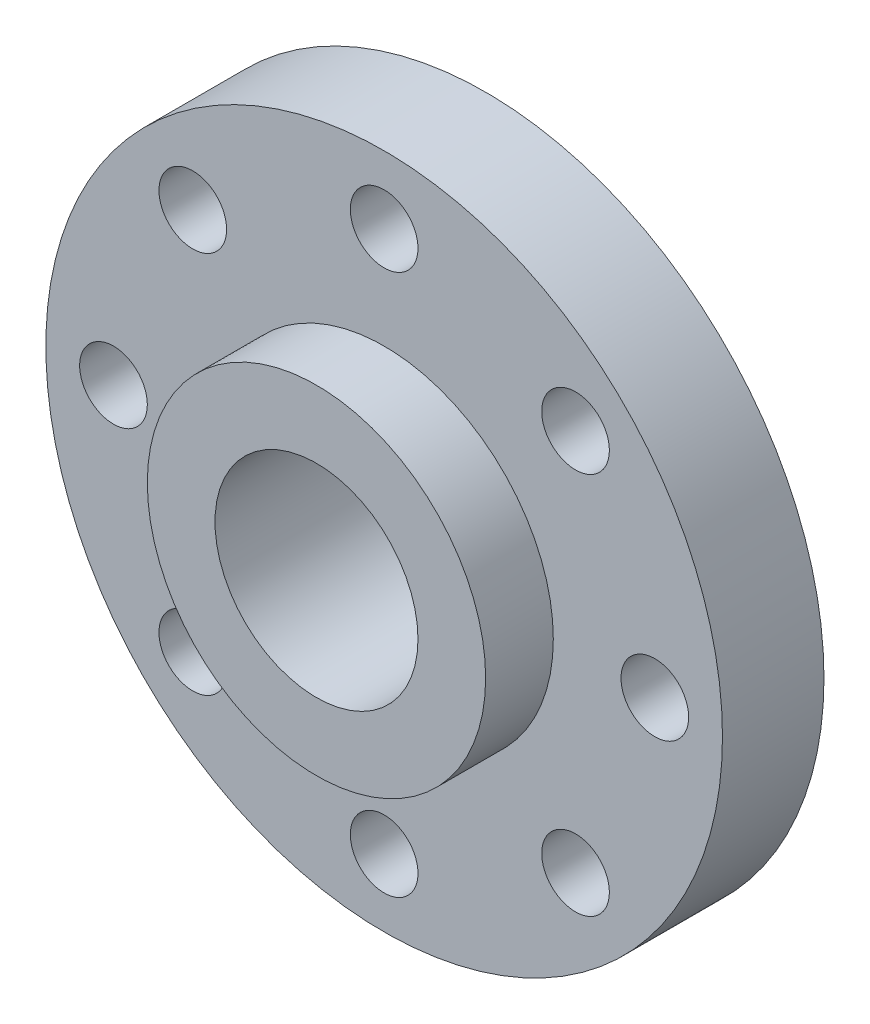
from build123d import *

# Parameters (mm, degrees)
SKETCH_1_R          = 10
EXTRUDE_1_DEPTH     = 3
SKETCH_2_R          = 5
EXTRUDE_2_DEPTH     = 2
SKETCH_3_R          = 1
CUT_EXTRUDE_1_DEPTH = 15.456832295
SKETCH_4_R          = 3
CUT_EXTRUDE_2_DEPTH = 16


with BuildPart() as part:
    # 草图1 → 凸台-拉伸1 (new body)
    with BuildSketch(Plane.XY):
        Circle(SKETCH_1_R)
    extrude(amount=EXTRUDE_1_DEPTH)

    # 草图2 → 凸台-拉伸2 (add)
    with BuildSketch(Plane.XY.offset(3)):
        Circle(SKETCH_2_R)
    extrude(amount=EXTRUDE_2_DEPTH)

    # 草图3 → 切除-拉伸1 (cut, through all)
    with BuildSketch(Plane.XY.offset(3)):
        with Locations((0, 8)):
            Circle(SKETCH_3_R)
        with Locations((5.656854249, 5.656854249)):
            Circle(SKETCH_3_R)
        with Locations((8, 0)):
            Circle(SKETCH_3_R)
        with Locations((5.656854249, -5.656854249)):
            Circle(SKETCH_3_R)
        with Locations((0, -8)):
            Circle(SKETCH_3_R)
        with Locations((-5.656854249, -5.656854249)):
            Circle(SKETCH_3_R)
        with Locations((-8, 0)):
            Circle(SKETCH_3_R)
        with Locations((-5.656854249, 5.656854249)):
            Circle(SKETCH_3_R)
    extrude(amount=-CUT_EXTRUDE_1_DEPTH, mode=Mode.SUBTRACT)

    # 草图4 → 切除-拉伸2 (cut, through all)
    with BuildSketch(Plane.XY.offset(5)):
        Circle(SKETCH_4_R)
    extrude(amount=-CUT_EXTRUDE_2_DEPTH, mode=Mode.SUBTRACT)


solid = part.part
